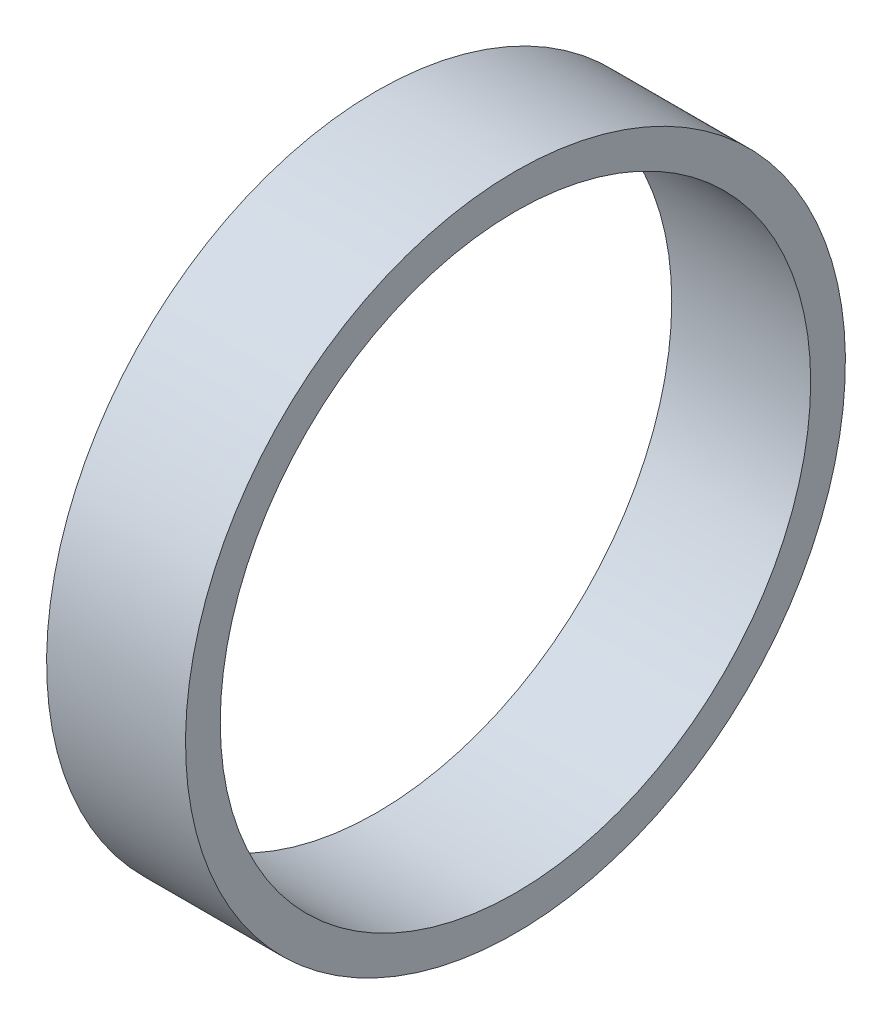
from build123d import *

# Parameters (mm, degrees)
SKETCH1_W      = 80
SKETCH1_H      = 20
REVOLVE1_ANGLE = 359.999999589


with BuildPart() as part:
    # Sketch1 → Revolve1 (revolve)
    with BuildSketch(Plane.XY):
        with Locations((1140, 180)):
            Rectangle(SKETCH1_W, SKETCH1_H)
    revolve(axis=Axis((0, 0, 0), (1, 0, 0)), revolution_arc=REVOLVE1_ANGLE)


solid = part.part
